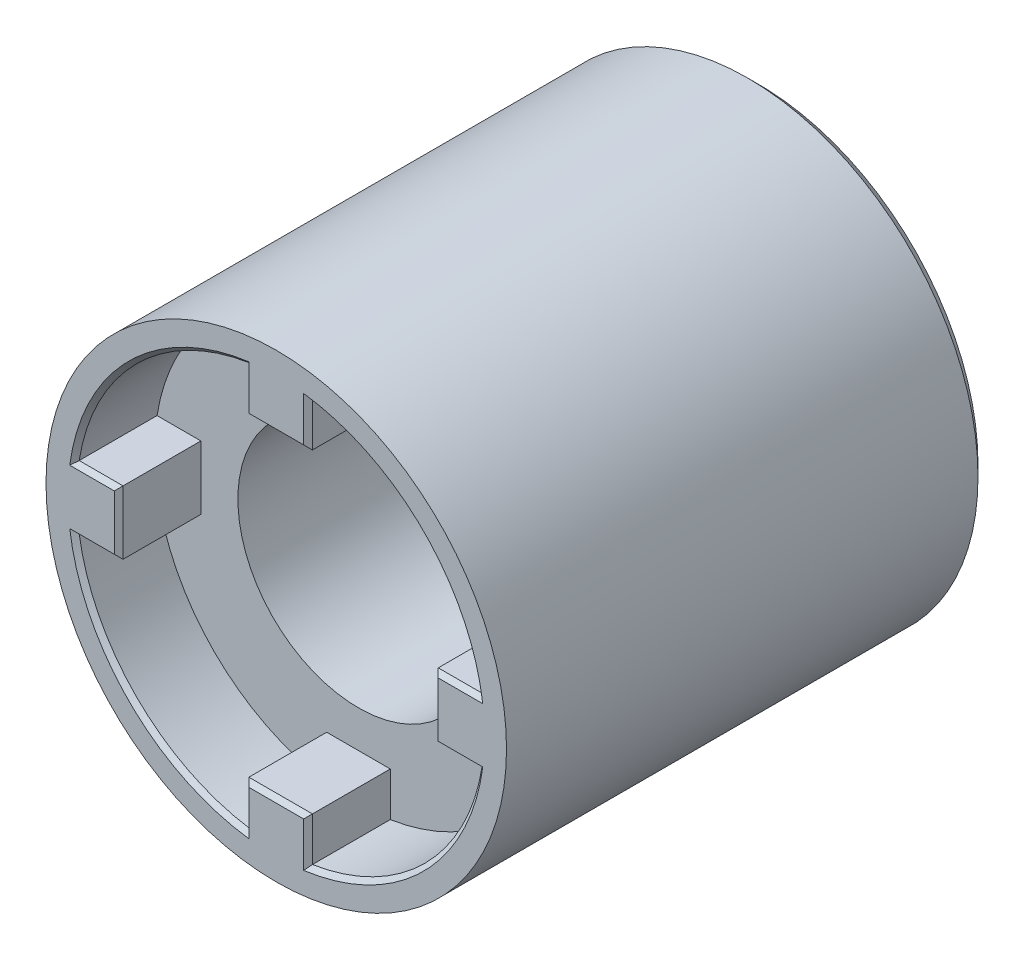
from build123d import *
from build123d.topology import SkipClean

# Parameters (mm, degrees)
SKETCH1_R           = 10.5
BOSS_EXTRUDE1_DEPTH = 22
SKETCH2_R           = 9.3
CUT_EXTRUDE1_DEPTH  = 3.75
BOSS_EXTRUDE3_START = 3.75
BOSS_EXTRUDE3_DEPTH = 3.75
CHAMFER1_SIZE       = 0.2
SKETCH4_W           = 6.6
SKETCH4_H           = 6.6
CUT_EXTRUDE2_DEPTH  = 24.527908959
CHAMFER2_SIZE       = 0.5
SKETCH6_R           = 5.5
CUT_EXTRUDE3_DEPTH  = 10


with BuildPart() as part:
    # Sketch1 → Boss-Extrude1 (new body)
    with BuildSketch(Plane.XY):
        Circle(SKETCH1_R)
    extrude(amount=BOSS_EXTRUDE1_DEPTH)

    # Sketch2 → Cut-Extrude1 (cut)
    with BuildSketch(Plane.XY.offset(22)):
        Circle(SKETCH2_R)
    extrude(amount=-CUT_EXTRUDE1_DEPTH, mode=Mode.SUBTRACT)

    # Sketch3 → Boss-Extrude3 (add)
    with BuildSketch(Plane.XY.offset(18.25).offset(BOSS_EXTRUDE3_START)):
        with BuildLine():
            Line((-1.45, 9.186266924), (-1.45, 7.186266924))
            Line((-1.45, 7.186266924), (1.45, 7.186266924))
            Line((1.45, 7.186266924), (1.45, 9.186266924))
            ThreePointArc((1.45, 9.186266924), (0, 9.3), (-1.45, 9.186266924))
        make_face()
        with BuildLine():
            Line((7.186266924, -1.45), (9.186266924, -1.45))
            ThreePointArc((9.186266924, -1.45), (9.3, 0), (9.186266924, 1.45))
            Line((9.186266924, 1.45), (7.186266924, 1.45))
            Line((7.186266924, 1.45), (7.186266924, -1.45))
        make_face()
        with BuildLine():
            Line((-1.45, -7.186266924), (-1.45, -9.186266924))
            ThreePointArc((-1.45, -9.186266924), (0, -9.3), (1.45, -9.186266924))
            Line((1.45, -9.186266924), (1.45, -7.186266924))
            Line((1.45, -7.186266924), (-1.45, -7.186266924))
        make_face()
        with BuildLine():
            Line((-7.186266924, 1.45), (-9.186266924, 1.45))
            ThreePointArc((-9.186266924, 1.45), (-9.3, 0), (-9.186266924, -1.45))
            Line((-9.186266924, -1.45), (-7.186266924, -1.45))
            Line((-7.186266924, -1.45), (-7.186266924, 1.45))
        make_face()
    extrude(amount=-BOSS_EXTRUDE3_DEPTH)

    # Chamfer1
    chamfer1_edges = [part.edges().sort_by_distance(p)[0] for p in [
        (-6.576093065, 6.576093065, 22),
        (1.45, 8.186266924, 22),
        (-1.45, 8.186266924, 22),
        (0, 7.186266924, 22),
        (6.576093065, 6.576093065, 22),
        (8.186266924, -1.45, 22),
        (8.186266924, 1.45, 22),
        (7.186266924, 0, 22),
        (6.576093065, -6.576093065, 22),
        (-1.45, -8.186266924, 22),
        (1.45, -8.186266924, 22),
        (0, -7.186266924, 22),
        (-6.576093065, -6.576093065, 22),
        (-8.186266924, 1.45, 22),
        (-8.186266924, -1.45, 22),
        (-7.186266924, 0, 22),
    ]]
    chamfer(chamfer1_edges, length=CHAMFER1_SIZE)

    # Sketch4 → Cut-Extrude2 (cut, through all)
    with BuildSketch(Plane.XY.offset(18.25)):
        Rectangle(SKETCH4_W, SKETCH4_H)
    extrude(amount=-CUT_EXTRUDE2_DEPTH, mode=Mode.SUBTRACT)

    # Chamfer2
    chamfer2_edges = [part.edges().sort_by_distance(p)[0] for p in [
        (3.3, 0, 0),
        (0, -3.3, 0),
        (-3.3, 0, 0),
        (0, 3.3, 0),
        (-10.5, 0, 0),
    ]]
    chamfer(chamfer2_edges, length=CHAMFER2_SIZE)

    # Sketch5 → Cut-Revolve1 (revolve, cut)
    with SkipClean():  # the faces are left unmerged after this step: merging them gives an invalid solid
        with BuildSketch(Plane(origin=(0, 0, 0), x_dir=(1, 0, 0), z_dir=(0, 1, 0))):
            with BuildLine():
                Line((3.3, -1.5), (3.3, -4.5))
                ThreePointArc((3.3, -4.5), (4.8, -3), (3.3, -1.5))
            make_face()
        revolve(axis=Axis((3.3, 0, 6.635415663), (0, 0, -1)), mode=Mode.SUBTRACT)

    # Sketch6 → Cut-Extrude3 (cut)
    with SkipClean():  # the faces are left unmerged after this step: merging them gives an invalid solid
        with BuildSketch(Plane.XY.offset(18.25)):
            Circle(SKETCH6_R)
        extrude(amount=-CUT_EXTRUDE3_DEPTH, mode=Mode.SUBTRACT)


solid = part.part
